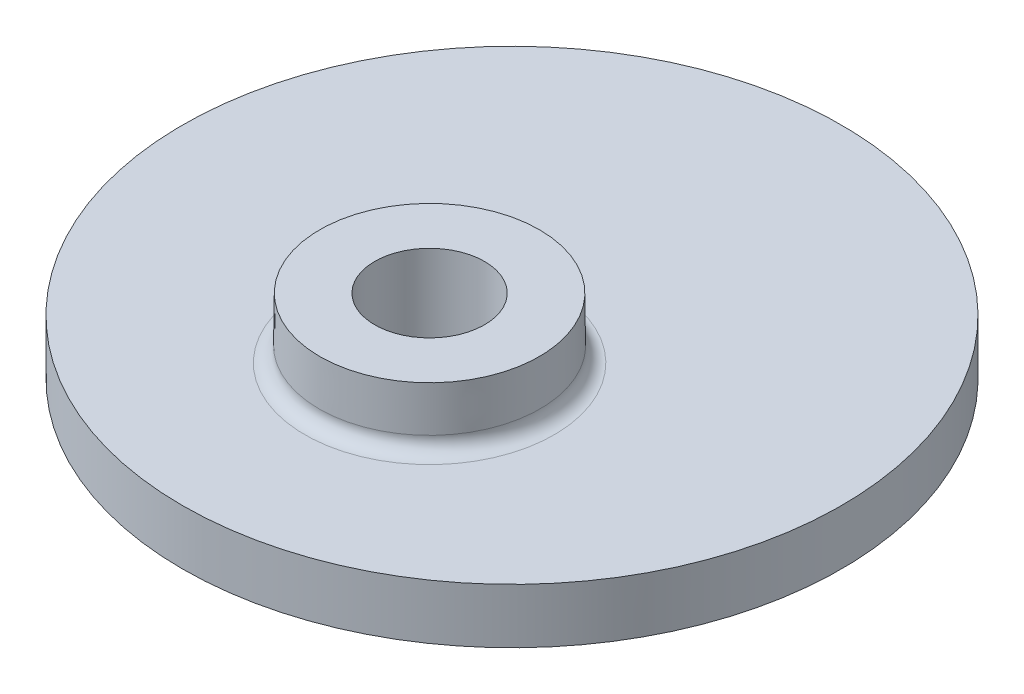
from build123d import *

# Parameters (mm, degrees)
CROQUIS4_OUTSIDE_W    = 159.554
CROQUIS4_OUTSIDE_H    = 159.554
CROQUIS4_OUTSIDE_R    = 30
CORTAR_EXTRUIR9_DEPTH = 10


with BuildPart() as part:
    # Croquis1 → Revolución1 (revolve)
    with BuildSketch(Plane.XY, mode=Mode.PRIVATE) as revoluci_n1_sk:
        with BuildLine():
            Line((5, 8), (10, 8))
            Line((10, 8), (10.051225386, 3.891))
            ThreePointArc((10.051225386, 3.891), (10.39716845, 2.91351819), (11.348036475, 2.5))
            Line((11.348036475, 2.5), (61.351351351, 2.5))
            Line((61.351351351, 2.5), (61.351351351, -2.5))
            Line((61.351351351, -2.5), (11.351351351, -2.5))
            ThreePointArc((11.351351351, -2.5), (10.398380886, -2.912350032), (10.051351351, -3.891))
            Line((10.051351351, -3.891), (10, -8))
            Line((10, -8), (5, -8))
            Line((5, -8), (5, 8))
        make_face()
    revolve(revoluci_n1_sk.sketch.rotate(Axis((0, -587.784635029, 0), (0, 1, 0)), 90), axis=Axis((0, -587.784635029, 0), (0, 1, 0)))

    # Croquis4 outside → Cortar-Extruir9 (cut)
    with BuildSketch(Plane(origin=(0, 2.5, 0), x_dir=(1, 0, 0), z_dir=(0, 1, 0))):
        Rectangle(CROQUIS4_OUTSIDE_W, CROQUIS4_OUTSIDE_H)
        with Locations(Location((0, 7.5, 0), (0, 0, 270))):
            Circle(CROQUIS4_OUTSIDE_R, mode=Mode.SUBTRACT)
    extrude(amount=-CORTAR_EXTRUIR9_DEPTH, mode=Mode.SUBTRACT)


solid = part.part
